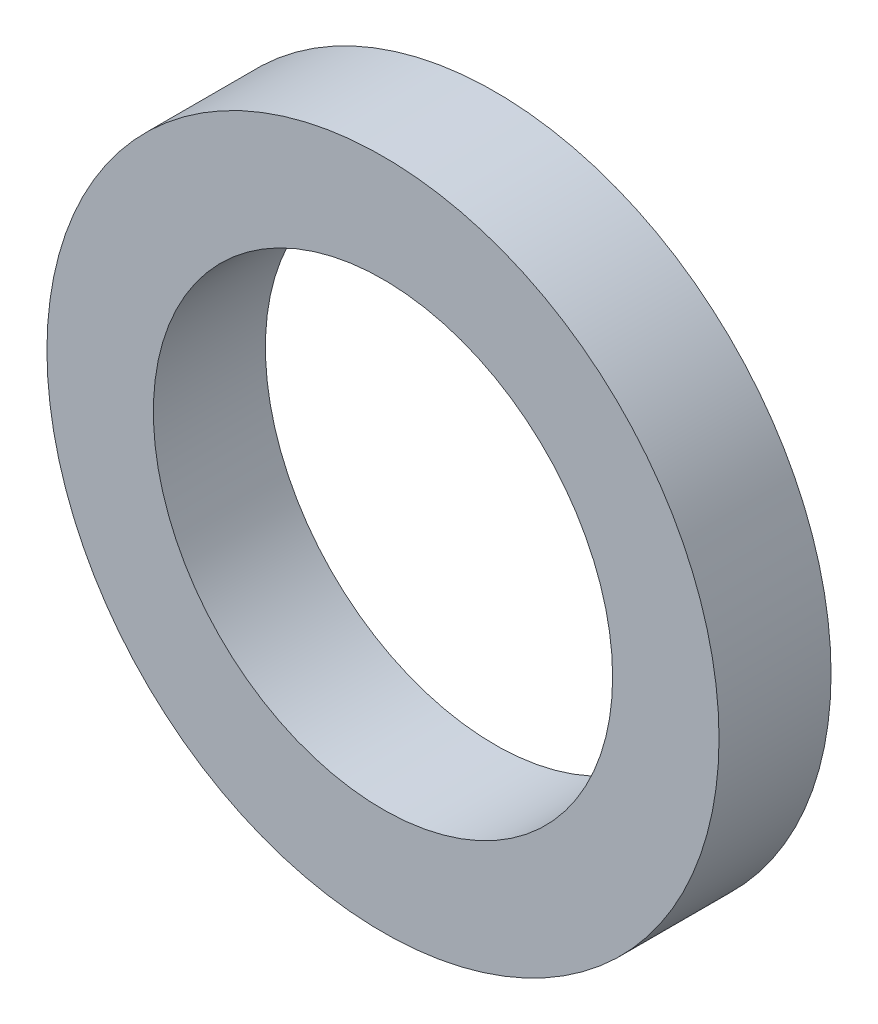
from build123d import *

# Parameters (mm, degrees)
SKETCH1_R           = 6
SKETCH1_R_2         = 4.1
BOSS_EXTRUDE1_DEPTH = 2


with BuildPart() as part:
    # Sketch1 → Boss-Extrude1 (new body)
    with BuildSketch(Plane.XY):
        Circle(SKETCH1_R)
        Circle(SKETCH1_R_2, mode=Mode.SUBTRACT)
    extrude(amount=BOSS_EXTRUDE1_DEPTH)


solid = part.part
